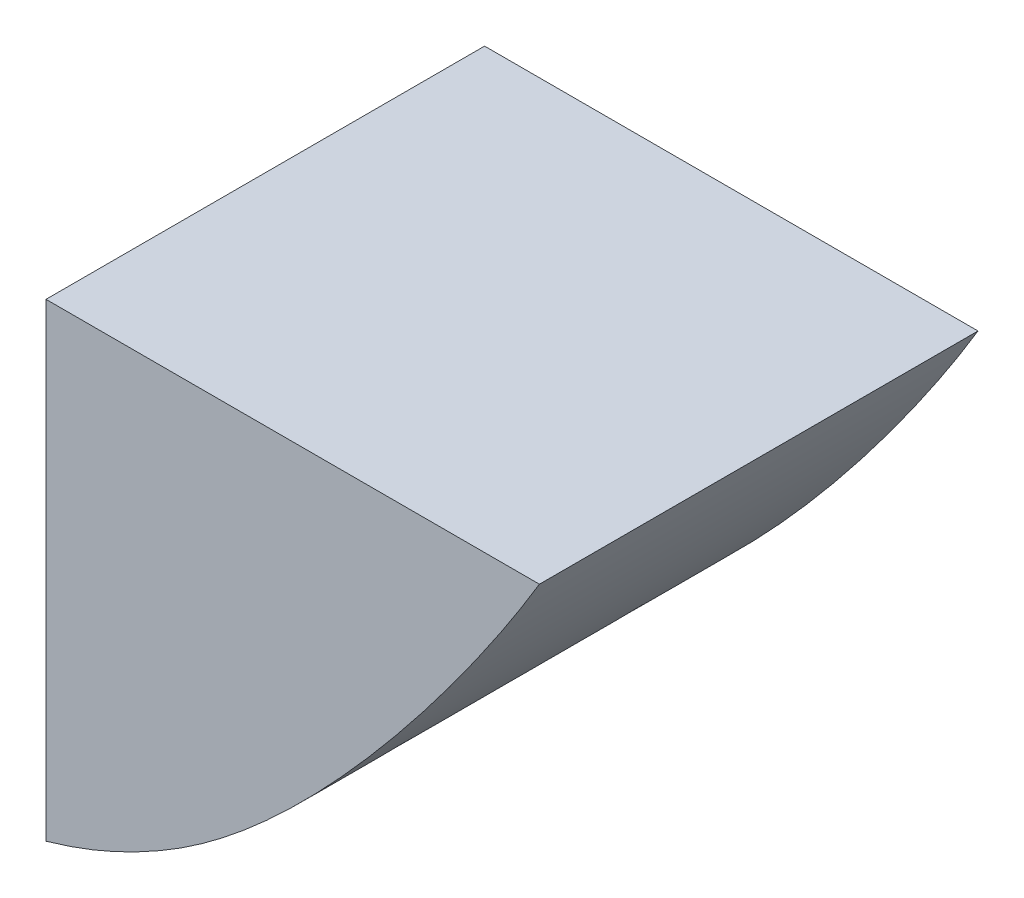
from build123d import *

# Parameters (mm, degrees)
FEATURE_PRISM_DEPTH = 8
PROFILE_CUT_W       = 5
PROFILE_CUT_H       = 13
FEATURE_TRIM_DEPTH  = 18.000000171


with BuildPart() as part:
    # profile:rational → feature:prism (new body)
    with BuildSketch(Plane.XY):
        with BuildLine():
            Line((12, 9), (0, 9))
            Line((0, 9), (0, 0))
            add(Edge.make_bspline(
                [(0, 0), (2, 0), (5, 1), (9, 4), (12, 9)],
                knots=[0, 0, 0, 0, 0.4, 1, 1, 1, 1], degree=3, weights=[1, 0.8, 1.3, 0.9, 1.1]))
        make_face()
    extrude(amount=FEATURE_PRISM_DEPTH)

    # profile:cut → feature:trim (cut, through all)
    with BuildSketch(Plane.XY):
        with Locations((0.5, 4.5)):
            Rectangle(PROFILE_CUT_W, PROFILE_CUT_H)
    extrude(amount=FEATURE_TRIM_DEPTH, mode=Mode.SUBTRACT)


solid = part.part
